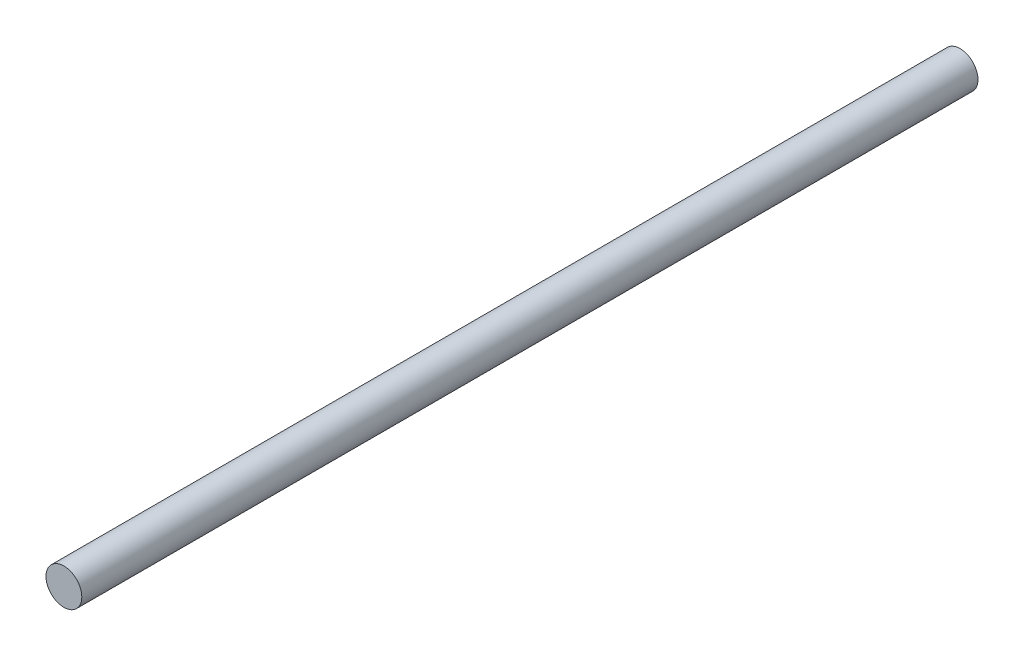
from build123d import *

# Parameters (mm, degrees)
SKETCH_1_R      = 4
EXTRUDE_1_DEPTH = 200


with BuildPart() as part:
    # Эскиз1 → Бобышка-Вытянуть1 (new body)
    with BuildSketch(Plane.XY):
        Circle(SKETCH_1_R)
    extrude(amount=-EXTRUDE_1_DEPTH)


solid = part.part
